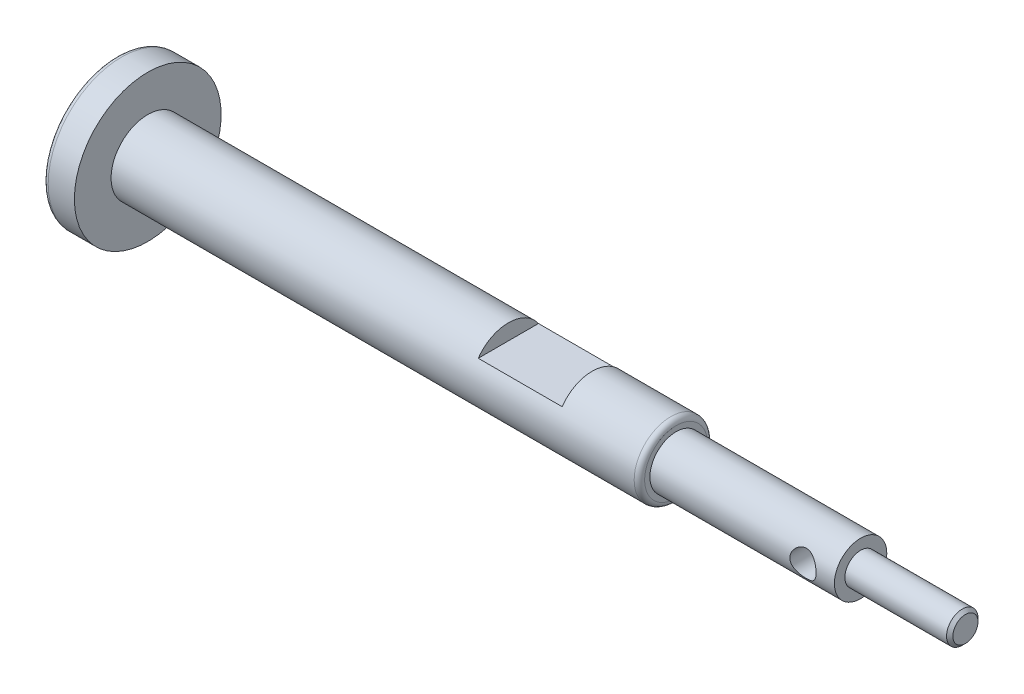
from build123d import *

# Parameters (mm, degrees)
SKETCH_1_R               = 3.5
EXTRUDE_1_DEPTH          = 90
SKETCH_2_R               = 7
EXTRUDE_2_DEPTH          = 3
FILLET_1_R               = 0.5
CUT_EXTRUDE_1_DEPTH      = 91.542807555
CUT_EXTRUDE_1_DEPTH_BACK = 91.542807555
SKETCH_3_W               = 8
SKETCH_3_H               = 1.5
SKETCH_4_W               = 39.6
SKETCH_4_H               = 1
FILLET_2_R               = 0.5
CUT_EXTRUDE_START        = -22
SKETCH_5_R               = 2.5
SKETCH_5_R_2             = 1.5
CUT_EXTRUDE_2_DEPTH      = 22
CUT_EXTRUDE_3_DEPTH      = 91.542807555
CUT_EXTRUDE_3_DEPTH_BACK = 91.542807555
SKETCH_6_R               = 1.25
SKETCH_7_R               = 4.059056145
CUT_EXTRUDE_4_DEPTH      = 12
CHAMFER_1_SIZE           = 0.3


with BuildPart() as part:
    # 草图1 → 凸台-拉伸1 (new body)
    with BuildSketch(Plane(origin=(0, 0, 0), x_dir=(0, 0, -1), z_dir=(1, 0, 0))):
        with Locations(Location((0, 0, 0), (0, 0, 180))):
            Circle(SKETCH_1_R)
    extrude(amount=EXTRUDE_1_DEPTH)

    # 草图2 → 凸台-拉伸2 (add)
    with BuildSketch(Plane.ZY):
        Circle(SKETCH_2_R)
    extrude(amount=EXTRUDE_2_DEPTH)

    # 圆角1
    fillet_1_edges = [part.edges().sort_by_distance(p)[0] for p in [
        (-3, 0, -7),
    ]]
    fillet(fillet_1_edges, radius=FILLET_1_R)

    # 草图3 → 切除-拉伸1 (cut, two sides: drawn at the far end of the back side and taken through both)
    with BuildSketch(Plane.XY.offset(-CUT_EXTRUDE_1_DEPTH_BACK)):
        with Locations((38.4, 2.75)):
            Rectangle(SKETCH_3_W, SKETCH_3_H)
    extrude(amount=CUT_EXTRUDE_1_DEPTH + CUT_EXTRUDE_1_DEPTH_BACK, mode=Mode.SUBTRACT)

    # 草图4 → 切除-旋转1 (revolve, cut)
    with BuildSketch(Plane.XY, mode=Mode.PRIVATE) as cut_revolve_1_sk:
        with Locations((70.2, 3)):
            Rectangle(SKETCH_4_W, SKETCH_4_H)
    revolve(cut_revolve_1_sk.sketch.rotate(Axis((34.4, 0, 0), (1, 0, 0)), 90), axis=Axis((34.4, 0, 0), (1, 0, 0)), mode=Mode.SUBTRACT)

    # 圆角2
    fillet_2_edges = [part.edges().sort_by_distance(p)[0] for p in [
        (50.4, 0, -3.5),
    ]]
    fillet(fillet_2_edges, radius=FILLET_2_R)

    # 草图5 → 切除-拉伸2 (cut)
    with BuildSketch(Plane(origin=(90, 0, 0), x_dir=(0, 0, -1), z_dir=(1, 0, 0)).offset(CUT_EXTRUDE_START)):
        with Locations(Location((0, 0, 0), (0, 0, 180))):
            Circle(SKETCH_5_R)
        Circle(SKETCH_5_R_2, mode=Mode.SUBTRACT)
    extrude(amount=CUT_EXTRUDE_2_DEPTH, mode=Mode.SUBTRACT)

    # 草图6 → 切除-拉伸3 (cut, two sides: drawn at the far end of the back side and taken through both)
    with BuildSketch(Plane.XY.offset(-CUT_EXTRUDE_3_DEPTH_BACK)):
        with Locations((65, 0)):
            Circle(SKETCH_6_R)
    extrude(amount=CUT_EXTRUDE_3_DEPTH + CUT_EXTRUDE_3_DEPTH_BACK, mode=Mode.SUBTRACT)

    # 草图7 → 切除-拉伸4 (cut)
    with BuildSketch(Plane(origin=(90, 0, 0), x_dir=(0, 0, -1), z_dir=(1, 0, 0))):
        Circle(SKETCH_7_R)
    extrude(amount=-CUT_EXTRUDE_4_DEPTH, mode=Mode.SUBTRACT)

    # 倒角1
    chamfer_1_edges = [part.edges().sort_by_distance(p)[0] for p in [
        (78, 0, 1.5),
    ]]
    chamfer(chamfer_1_edges, length=CHAMFER_1_SIZE)


solid = part.part
